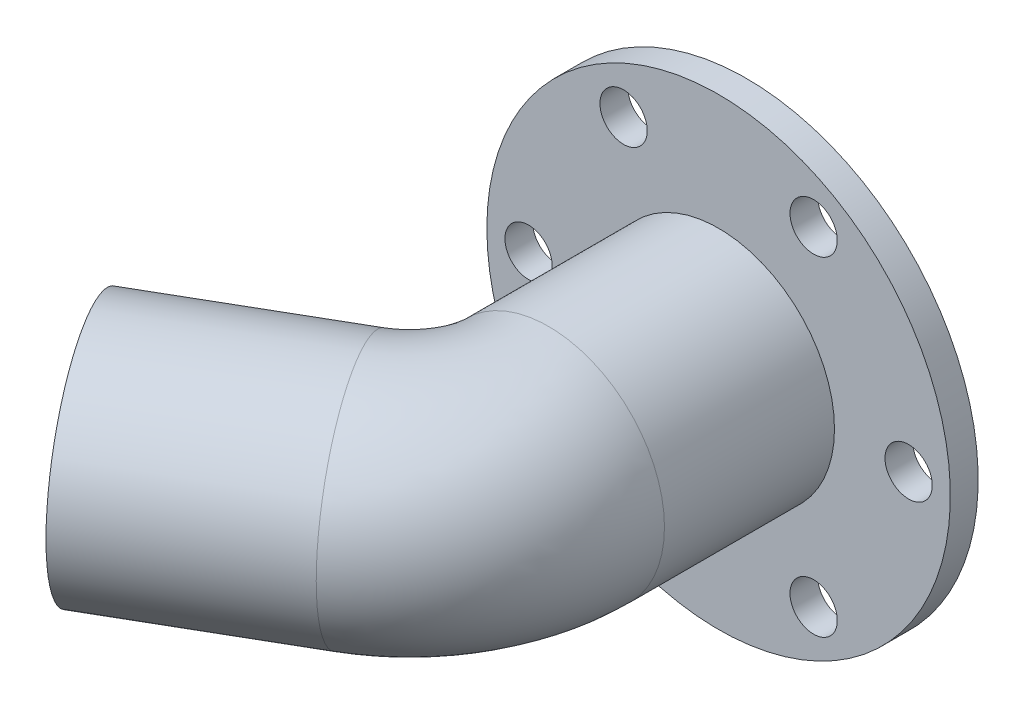
from build123d import *

# Parameters (mm, degrees)
SKETCH_1_R               = 25
SKETCH_1_R_2             = 15
EXTRUDE_START            = -25
SKETCH_3_R               = 36
SKETCH_3_R_2             = 25
EXTRUDE_2_DEPTH          = 5
SKETCH_4_W               = 10
SKETCH_4_H               = 4
CUT_EXTRUDE_START        = -20
SKETCH_5_R               = 25
CUT_EXTRUDE_1_DEPTH      = 20
EXTRUDE_START_2          = -6
SKETCH_6_R               = 50
SKETCH_6_R_2             = 15
EXTRUDE_3_DEPTH          = 6
CUT_EXTRUDE_2_REACH      = 140.279
SKETCH_7_R               = 5.1
PATTERN_CIRCULAR_1_COUNT = 6


with BuildPart() as part:
    # По траектории1: sweep along a path in Эскиз2
    with BuildLine(Plane(origin=(0, 0, 0), x_dir=(1, 0, 0), z_dir=(0, 1, 0))) as sweep_1_path:
        Line((0, 0), (0, -62.679491924))
        ThreePointArc((0, -62.679491924), (-4.019237886, -77.679491924), (-15, -88.660254038))
        Line((-15, -88.660254038), (-51.961524227, -110))
    # Эскиз1 → По траектории1 (sweep)
    with BuildSketch(Plane.XY):
        Circle(SKETCH_1_R)
        Circle(SKETCH_1_R_2, mode=Mode.SUBTRACT)
    sweep(path=sweep_1_path.line)

    # Эскиз3 → Бобышка-Вытянуть2 (add)
    with BuildSketch(Plane(origin=(0, 0, 0), x_dir=(-1, 0, 0), z_dir=(0, 0, -1)).offset(EXTRUDE_START)):
        Circle(SKETCH_3_R)
        Circle(SKETCH_3_R_2, mode=Mode.SUBTRACT)
    extrude(amount=EXTRUDE_2_DEPTH)

    # Эскиз4 → Вырез-Повернуть1 (revolve, cut)
    with BuildSketch(Plane(origin=(0, 0, 0), x_dir=(1, 0, 0), z_dir=(0, 1, 0)), mode=Mode.PRIVATE) as cut_revolve_1_sk:
        with Locations((27, -18)):
            Rectangle(SKETCH_4_W, SKETCH_4_H)
    revolve(cut_revolve_1_sk.sketch.rotate(Axis((0, 0, 0), (0, 0, 1)), 180), axis=Axis((0, 0, 0), (0, 0, 1)), mode=Mode.SUBTRACT)

    # Эскиз5 → Вырез-Вытянуть1 (cut)
    with BuildSketch(Plane(origin=(0, 0, 0), x_dir=(-1, 0, 0), z_dir=(0, 0, -1)).offset(CUT_EXTRUDE_START)):
        Circle(SKETCH_5_R)
    extrude(amount=CUT_EXTRUDE_1_DEPTH, mode=Mode.SUBTRACT)

    # Эскиз6 → Бобышка-Вытянуть3 (add)
    with BuildSketch(Plane(origin=(0, 0, 20), x_dir=(-1, 0, 0), z_dir=(0, 0, -1)).offset(EXTRUDE_START_2)):
        Circle(SKETCH_6_R)
        Circle(SKETCH_6_R_2, mode=Mode.SUBTRACT)
    extrude(amount=EXTRUDE_3_DEPTH)

    # Эскиз7 → Вырез-Вытянуть2 (cut, up to next)
    with BuildSketch(Plane(origin=(0, 0, 20), x_dir=(-1, 0, 0), z_dir=(0, 0, -1)), mode=Mode.PRIVATE) as cut_extrude_2_sk1:
        with Locations((-41, 0)):
            Circle(SKETCH_7_R)
    cut_extrude_2_tool1 = extrude(cut_extrude_2_sk1.sketch, amount=-CUT_EXTRUDE_2_REACH, mode=Mode.PRIVATE) & part.part
    cut_extrude_2 = cut_extrude_2_tool1.solids().sort_by_distance((41, 0, 20))[0]
    add(cut_extrude_2, mode=Mode.SUBTRACT)

    # Круговой массив1: Вырез-Вытянуть2 ×6 about axis
    pattern_circular_1_axis = Axis((0, 0, 0), (0, 0, 1))
    for i in range(1, PATTERN_CIRCULAR_1_COUNT):
        add(cut_extrude_2.rotate(pattern_circular_1_axis, i * 360 / PATTERN_CIRCULAR_1_COUNT), mode=Mode.SUBTRACT)


solid = part.part
